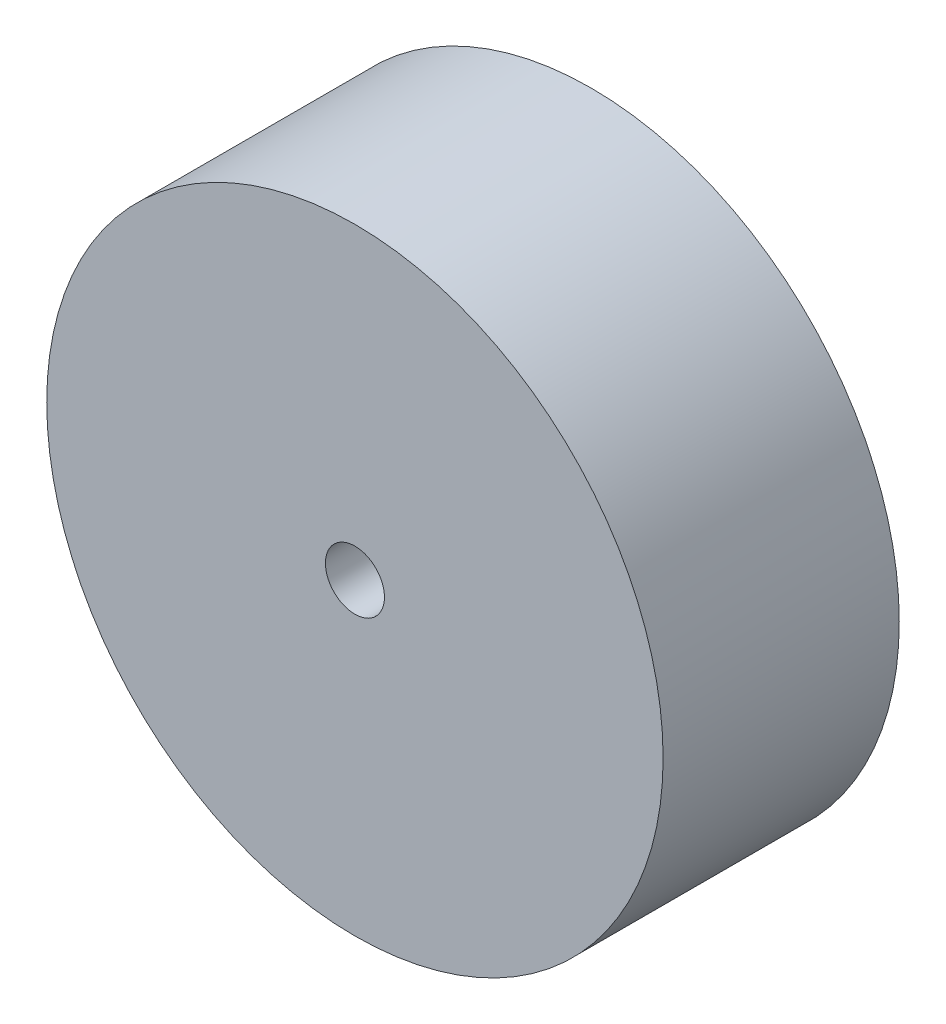
from build123d import *

# Parameters (mm, degrees)
SKETCH1_R                   = 33.149277239
BOSS_EXTRUDE1_DEPTH         = 25.4
F_1_4_0_25_DIAMETER_HOLE1_D = 6.35


with BuildPart() as part:
    # Sketch1 → Boss-Extrude1 (new body)
    with BuildSketch(Plane.XY):
        Circle(SKETCH1_R)
    extrude(amount=BOSS_EXTRUDE1_DEPTH)

    # 1/4 (0.25) Diameter Hole1 (through all)
    with Locations(Plane.XY.offset(25.4)):
        with Locations((0, 0)):
            Hole(F_1_4_0_25_DIAMETER_HOLE1_D / 2)


solid = part.part
